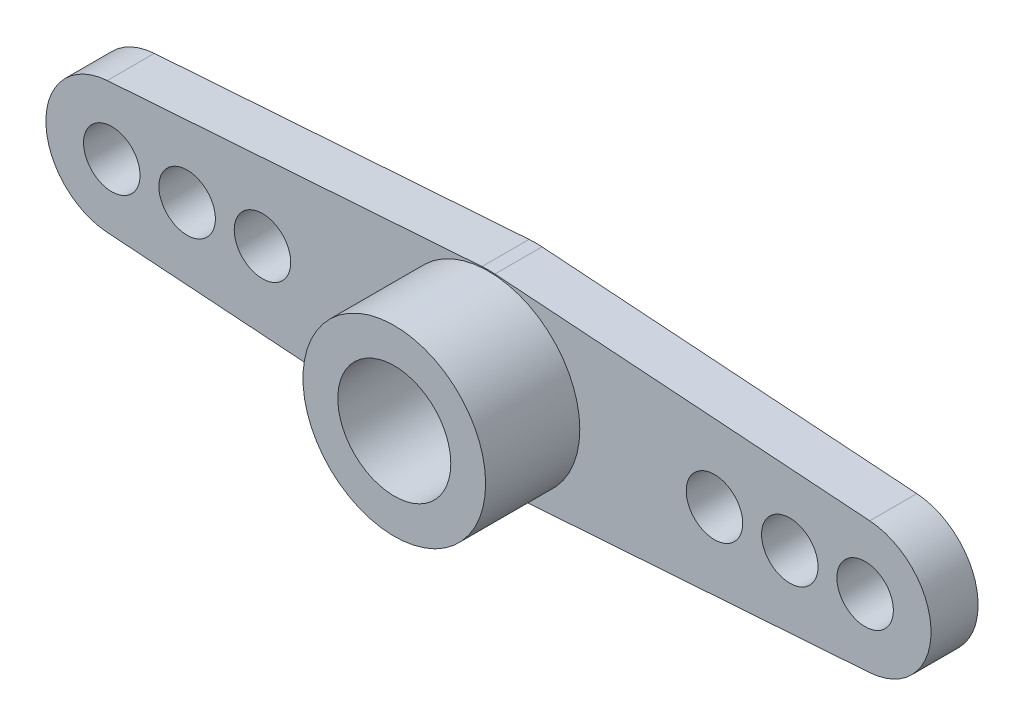
from build123d import *

# Parameters (mm, degrees)
SKETCH_1_R      = 1.5
SKETCH_1_R_2    = 3
EXTRUDE_1_DEPTH = 2.5
SKETCH_2_R      = 4.85
SKETCH_2_R_2    = 3
EXTRUDE_2_DEPTH = 5


with BuildPart() as part:
    # 草图1 → 凸台-拉伸1 (new body)
    with BuildSketch(Plane.XY):
        with BuildLine():
            Line((-0.343, -4.887980258), (-20.245, -3.49141447))
            ThreePointArc((-20.245, -3.49141447), (-23.5, 0), (-20.245, 3.49141447))
            Line((-20.245, 3.49141447), (-0.343, 4.887980258))
            ThreePointArc((-0.343, 4.887980258), (0, 4.9), (0.343, 4.887980258))
            Line((0.343, 4.887980258), (20.245, 3.49141447))
            ThreePointArc((20.245, 3.49141447), (23.5, 0), (20.245, -3.49141447))
            Line((20.245, -3.49141447), (0.343, -4.887980258))
            ThreePointArc((0.343, -4.887980258), (0, -4.9), (-0.343, -4.887980258))
        make_face()
        with Locations((20, 0)):
            Circle(SKETCH_1_R, mode=Mode.SUBTRACT)
        with Locations((16, 0)):
            Circle(SKETCH_1_R, mode=Mode.SUBTRACT)
        with Locations((12, 0)):
            Circle(SKETCH_1_R, mode=Mode.SUBTRACT)
        Circle(SKETCH_1_R_2, mode=Mode.SUBTRACT)
        with Locations(Location((-12, 0, 0), (0, 0, 180))):
            Circle(SKETCH_1_R, mode=Mode.SUBTRACT)
        with Locations(Location((-16, 0, 0), (0, 0, 180))):
            Circle(SKETCH_1_R, mode=Mode.SUBTRACT)
        with Locations(Location((-20, 0, 0), (0, 0, 180))):
            Circle(SKETCH_1_R, mode=Mode.SUBTRACT)
    extrude(amount=EXTRUDE_1_DEPTH)

    # 草图2 → 凸台-拉伸2 (add)
    with BuildSketch(Plane.XY.offset(2.5)):
        Circle(SKETCH_2_R)
        Circle(SKETCH_2_R_2, mode=Mode.SUBTRACT)
    extrude(amount=EXTRUDE_2_DEPTH)


solid = part.part
